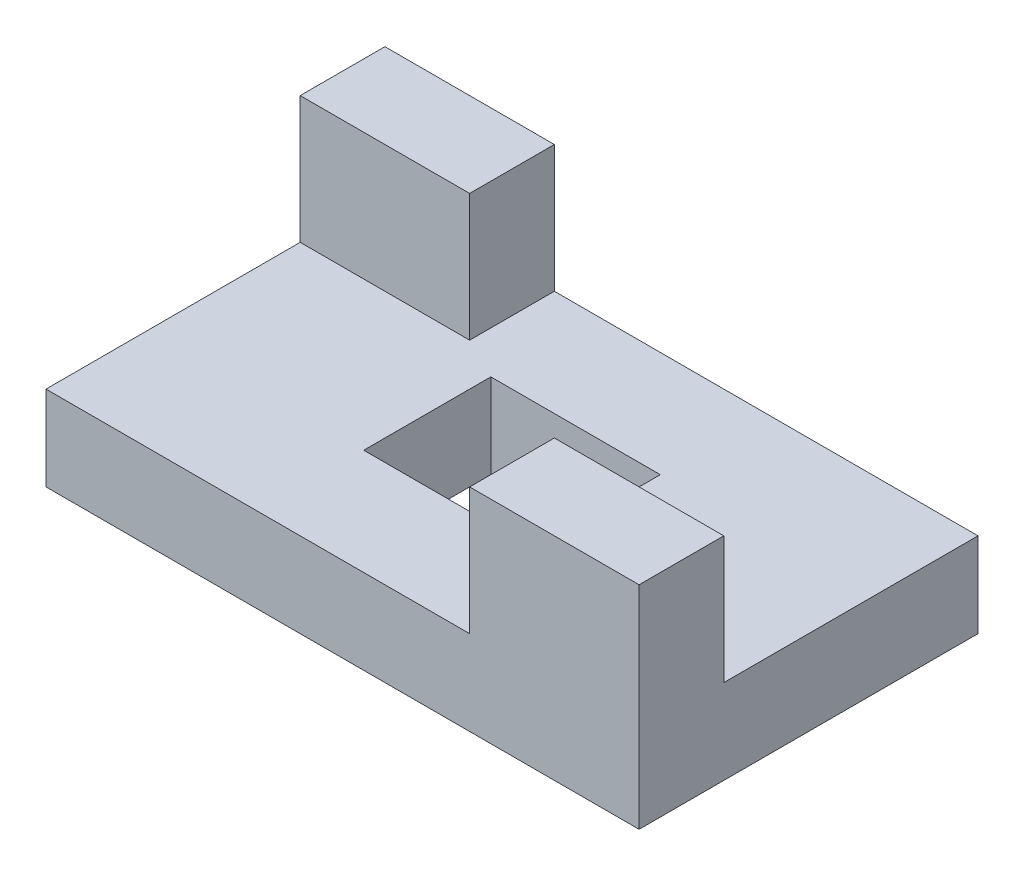
from build123d import *

# Parameters (mm, degrees)
SKETCH1_3_W         = 16
SKETCH1_3_H         = 12
BOSS_EXTRUDE2_DEPTH = 8
SKETCH1_4_W         = 16
SKETCH1_4_H         = 8
BOSS_EXTRUDE3_DEPTH = 20


with BuildPart() as part:
    # Sketch1<3> → Boss-Extrude2 (new body)
    with BuildSketch(Plane(origin=(0, 0, 0), x_dir=(1, 0, 0), z_dir=(0, 1, 0))):
        Polygon((-28, 8), (-28, -16), (12, -16), (12, -8), (28, -8), (28, 16), (-12, 16), (-12, 8), align=None)
        Rectangle(SKETCH1_3_W, SKETCH1_3_H, mode=Mode.SUBTRACT)
    extrude(amount=BOSS_EXTRUDE2_DEPTH)

    # Sketch1<4> → Boss-Extrude3 (add)
    with BuildSketch(Plane(origin=(0, 0, 0), x_dir=(1, 0, 0), z_dir=(0, 1, 0))):
        with Locations((20, -12)):
            Rectangle(SKETCH1_4_W, SKETCH1_4_H)
        with Locations((-20, 12)):
            Rectangle(SKETCH1_4_W, SKETCH1_4_H)
    extrude(amount=BOSS_EXTRUDE3_DEPTH)


solid = part.part
